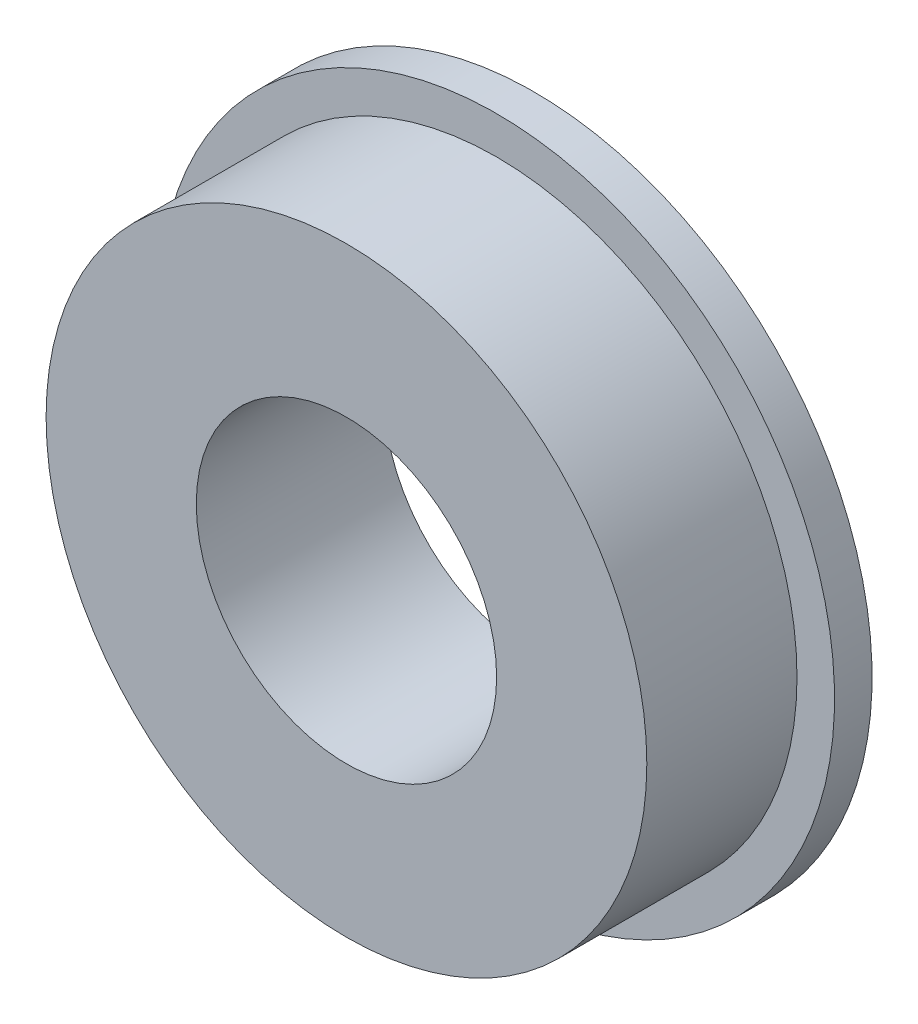
from build123d import *


with BuildPart() as part:
    # Sketch1 → Revolve1 (revolve)
    with BuildSketch(Plane(origin=(0, 0, 0), x_dir=(1, 0, 0), z_dir=(0, 1, 0)), mode=Mode.PRIVATE) as revolve1_sk:
        Polygon((4, 0), (9, 0), (9, -1), (8, -1), (8, -5), (4, -5), align=None)
    revolve(revolve1_sk.sketch.rotate(Axis((0, 0, 0), (0, 0, 1)), 180), axis=Axis((0, 0, 0), (0, 0, 1)))


solid = part.part
